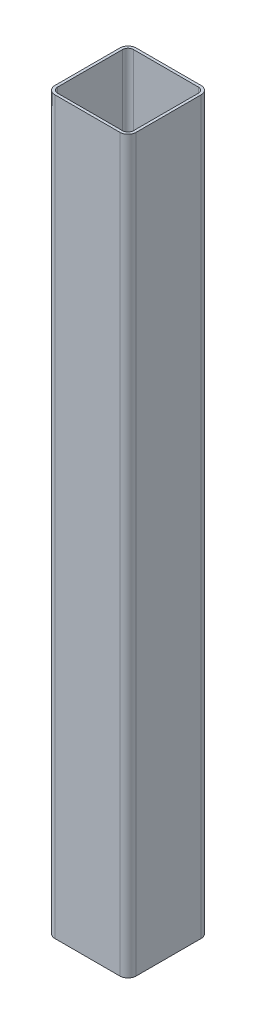
from build123d import *

# Parameters (mm, degrees)
BOSS_EXTRUDE1_DEPTH = 270
SHELL1_T            = -2


with BuildPart() as part:
    # Sketch1 → Boss-Extrude1 (new, symmetric)
    with BuildSketch(Plane(origin=(0, 0, 0), x_dir=(1, 0, 0), z_dir=(0, 1, 0))):
        with BuildLine():
            Line((-24, -30), (24, -30))
            ThreePointArc((24, -30), (28.242640687, -28.242640687), (30, -24))
            Line((30, -24), (30, 24))
            ThreePointArc((30, 24), (28.242640687, 28.242640687), (24, 30))
            Line((24, 30), (-24, 30))
            ThreePointArc((-24, 30), (-28.242640687, 28.242640687), (-30, 24))
            Line((-30, 24), (-30, -24))
            ThreePointArc((-30, -24), (-28.242640687, -28.242640687), (-24, -30))
        make_face()
    extrude(amount=BOSS_EXTRUDE1_DEPTH, both=True)

    # Shell1
    shell1_openings = [part.faces().sort_by_distance(p)[0] for p in [
        (0, 270, 0),
        (0, -270, 0),
    ]]
    offset(amount=SHELL1_T, openings=shell1_openings, kind=Kind.INTERSECTION)


solid = part.part
